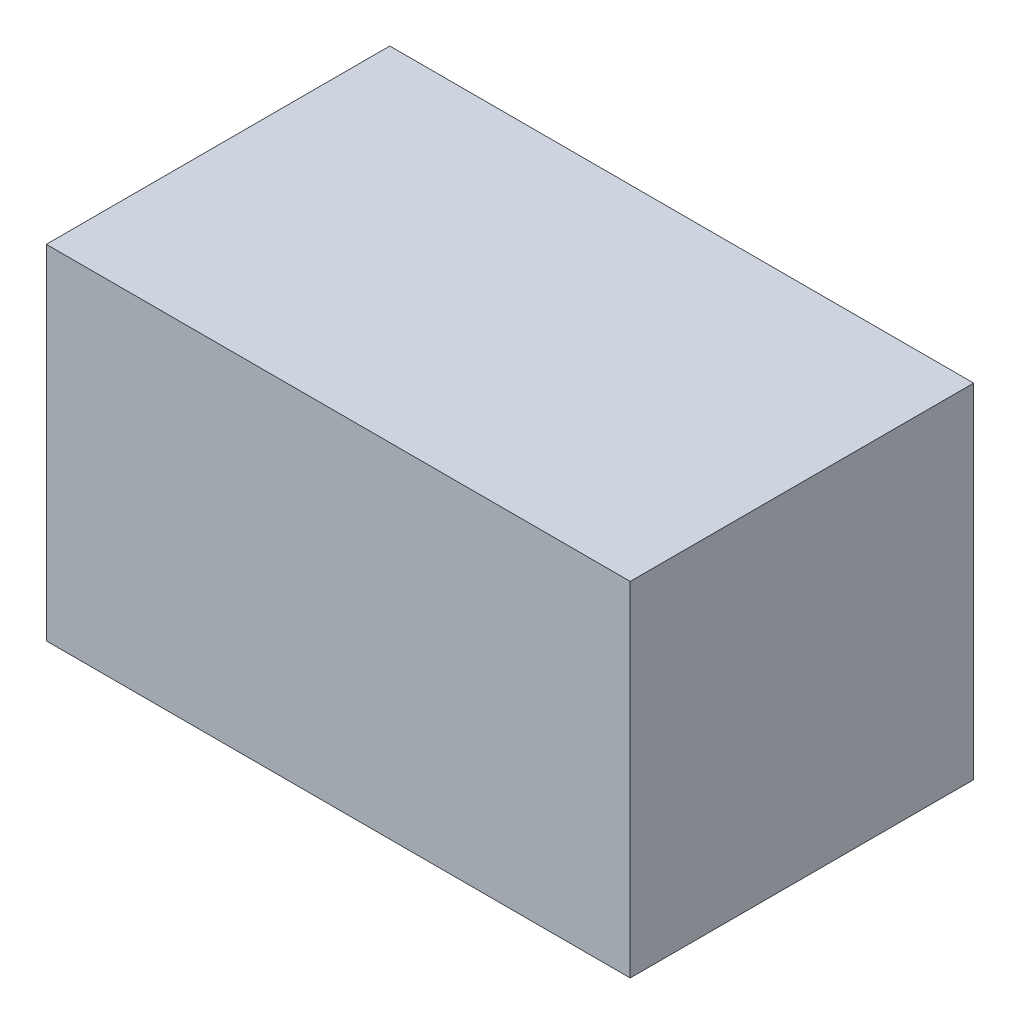
from build123d import *

# Parameters (mm, degrees)
SKETCH1_W           = 17
SKETCH1_H           = 10
BOSS_EXTRUDE1_DEPTH = 10


with BuildPart() as part:
    # Sketch1 → Boss-Extrude1 (new body)
    with BuildSketch(Plane(origin=(0, 0, 0), x_dir=(1, 0, 0), z_dir=(0, 1, 0))):
        with Locations((8.5, 5)):
            Rectangle(SKETCH1_W, SKETCH1_H)
    extrude(amount=BOSS_EXTRUDE1_DEPTH)


solid = part.part
